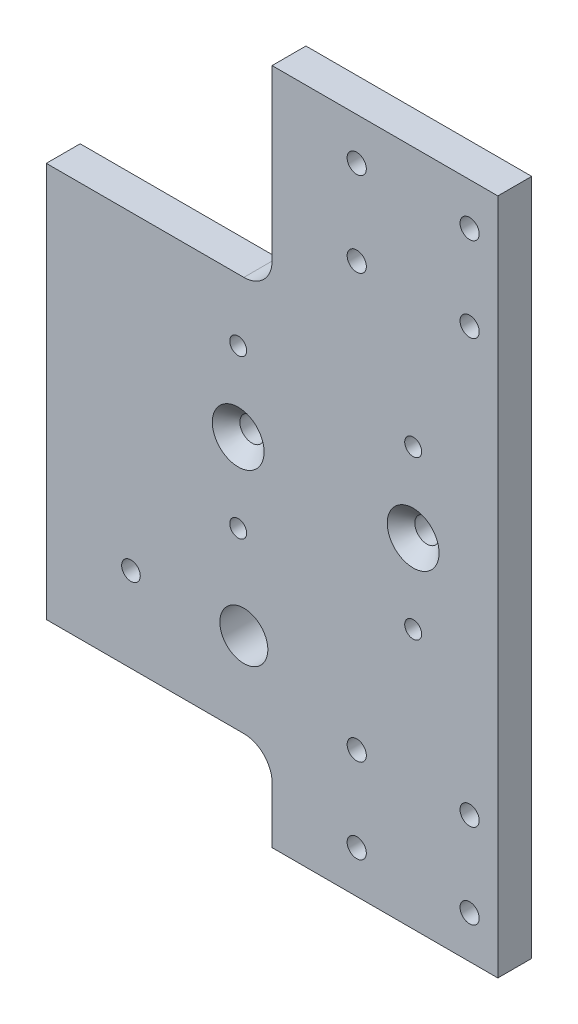
from build123d import *

# Parameters (mm, degrees)
SKIZZE1_W                                            = 80
SKIZZE1_H                                            = 120
AUFSATZ_LINEAR_AUSTRAGEN1_DEPTH                      = 6
FORMSENKUNG_F_R_M4_SENKSCHRAUBE_MIT_INNE_D           = 4.3
FORMSENKUNG_F_R_M4_SENKSCHRAUBE_MIT_INNE_DEPTH       = 11.5
FORMSENKUNG_F_R_M4_SENKSCHRAUBE_MIT_INNE_CSINK_D     = 9.18
FORMSENKUNG_F_R_M4_SENKSCHRAUBE_MIT_INNE_CSINK_ANGLE = 90
FORMSENKUNG_F_R_M4_SENKSCHRAUBE_MIT_INNE_TIP         = 1.291850331
F_3_0MM_STIFTLOCH1_D                                 = 3
F_3_0MM_STIFTLOCH1_DEPTH                             = 11.5
F_3_0MM_STIFTLOCH1_TIP                               = 0.901290929
STIRNSENKUNG_F_R_M3_FLACHKOPFSCHRAUBE_MI_D           = 3.4
STIRNSENKUNG_F_R_M3_FLACHKOPFSCHRAUBE_MI_DEPTH       = 8.5
STIRNSENKUNG_F_R_M3_FLACHKOPFSCHRAUBE_MI_CBORE_D     = 7
STIRNSENKUNG_F_R_M3_FLACHKOPFSCHRAUBE_MI_CBORE_DEPTH = 2.4
STIRNSENKUNG_F_R_M3_FLACHKOPFSCHRAUBE_MI_TIP         = 1.021463052
M10_GEWINDEBOHRUNG1_D                                = 8.5
SKIZZE28_W                                           = 40
SKIZZE28_H                                           = 35
SKIZZE28_H_2                                         = 15
SCHNITT_LINEAR_AUSTRAGEN1_DEPTH                      = 10
M4_GEWINDEBOHRUNG1_D                                 = 3.3
M4_GEWINDEBOHRUNG1_CSINK_D                           = 4.05
M4_GEWINDEBOHRUNG1_CSINK_ANGLE                       = 90
VERRUNDUNG1_R                                        = 5


with BuildPart() as part:
    # Skizze1 → Aufsatz-Linear austragen1 (new body)
    with BuildSketch(Plane.XY.offset(10)):
        with Locations((-40, 60)):
            Rectangle(SKIZZE1_W, SKIZZE1_H)
    extrude(amount=-AUFSATZ_LINEAR_AUSTRAGEN1_DEPTH)

    # Formsenkung für M4 Senkschraube mit Innensechskant1
    with Locations(Plane.XY.offset(10)):
        with Locations((-46, 60), (-15, 60)):
            CounterSinkHole(FORMSENKUNG_F_R_M4_SENKSCHRAUBE_MIT_INNE_D / 2, FORMSENKUNG_F_R_M4_SENKSCHRAUBE_MIT_INNE_CSINK_D / 2, depth=FORMSENKUNG_F_R_M4_SENKSCHRAUBE_MIT_INNE_DEPTH, counter_sink_angle=FORMSENKUNG_F_R_M4_SENKSCHRAUBE_MIT_INNE_CSINK_ANGLE)
            with Locations((0, 0, -(FORMSENKUNG_F_R_M4_SENKSCHRAUBE_MIT_INNE_DEPTH + FORMSENKUNG_F_R_M4_SENKSCHRAUBE_MIT_INNE_TIP / 2))):  # 118° drill point
                Cone(0, FORMSENKUNG_F_R_M4_SENKSCHRAUBE_MIT_INNE_D / 2, FORMSENKUNG_F_R_M4_SENKSCHRAUBE_MIT_INNE_TIP, mode=Mode.SUBTRACT)

    # Ø3.0mm Stiftloch1
    with Locations(Plane.XY.offset(10)):
        with Locations((-46, 74), (-15, 74), (-15, 46), (-46, 46)):
            Hole(F_3_0MM_STIFTLOCH1_D / 2, depth=F_3_0MM_STIFTLOCH1_DEPTH)
            with Locations((0, 0, -(F_3_0MM_STIFTLOCH1_DEPTH + F_3_0MM_STIFTLOCH1_TIP / 2))):  # 118° drill point
                Cone(0, F_3_0MM_STIFTLOCH1_D / 2, F_3_0MM_STIFTLOCH1_TIP, mode=Mode.SUBTRACT)

    # Stirnsenkung für M3 Flachkopfschraube mit Schlitz2
    with Locations(Plane(origin=(0, 0, 4), x_dir=(-1, 0, 0), z_dir=(0, 0, -1))):
        with Locations((25, 112.5), (25, 97.5), (5, 97.5), (5, 112.5), (25, 22.5), (25, 7.5), (5, 7.5), (5, 22.5)):
            CounterBoreHole(STIRNSENKUNG_F_R_M3_FLACHKOPFSCHRAUBE_MI_D / 2, STIRNSENKUNG_F_R_M3_FLACHKOPFSCHRAUBE_MI_CBORE_D / 2, STIRNSENKUNG_F_R_M3_FLACHKOPFSCHRAUBE_MI_CBORE_DEPTH, depth=STIRNSENKUNG_F_R_M3_FLACHKOPFSCHRAUBE_MI_DEPTH)
            with Locations((0, 0, -(STIRNSENKUNG_F_R_M3_FLACHKOPFSCHRAUBE_MI_DEPTH + STIRNSENKUNG_F_R_M3_FLACHKOPFSCHRAUBE_MI_TIP / 2))):  # 118° drill point
                Cone(0, STIRNSENKUNG_F_R_M3_FLACHKOPFSCHRAUBE_MI_D / 2, STIRNSENKUNG_F_R_M3_FLACHKOPFSCHRAUBE_MI_TIP, mode=Mode.SUBTRACT)

    # M10 Gewindebohrung1 (through all)
    with Locations(Plane(origin=(0, 0, 4), x_dir=(-1, 0, 0), z_dir=(0, 0, -1))):
        with Locations((45, 30)):
            Hole(M10_GEWINDEBOHRUNG1_D / 2)

    # Skizze28 → Schnitt-Linear austragen1 (cut)
    with BuildSketch(Plane(origin=(0, 0, 4), x_dir=(-1, 0, 0), z_dir=(0, 0, -1))):
        with Locations((60, 102.5)):
            Rectangle(SKIZZE28_W, SKIZZE28_H)
        with Locations((60, 7.5)):
            Rectangle(SKIZZE28_W, SKIZZE28_H_2)
    extrude(amount=-SCHNITT_LINEAR_AUSTRAGEN1_DEPTH, mode=Mode.SUBTRACT)

    # M4 Gewindebohrung1 (through all)
    with Locations(Plane(origin=(0, 0, 4), x_dir=(-1, 0, 0), z_dir=(0, 0, -1))):
        with Locations((65, 30)):
            CounterSinkHole(M4_GEWINDEBOHRUNG1_D / 2, M4_GEWINDEBOHRUNG1_CSINK_D / 2, counter_sink_angle=M4_GEWINDEBOHRUNG1_CSINK_ANGLE)

    # Verrundung1
    verrundung1_edges = [part.edges().sort_by_distance(p)[0] for p in [
        (-40, 85, 7),
        (-40, 15, 7),
    ]]
    fillet(verrundung1_edges, radius=VERRUNDUNG1_R)


solid = part.part
